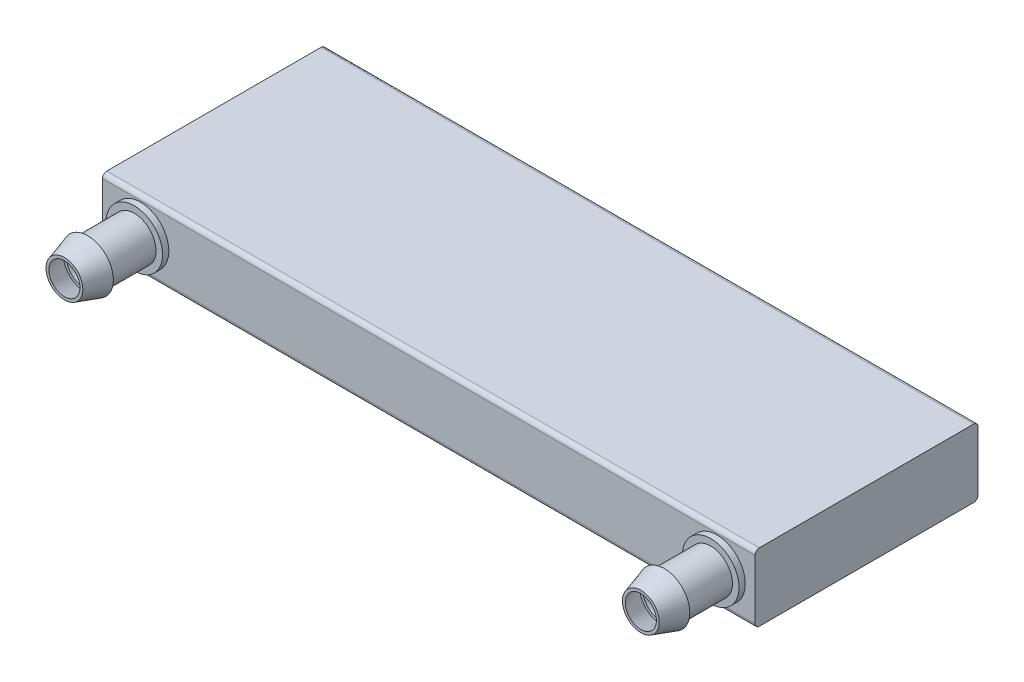
from build123d import *

# Parameters (mm, degrees)
SKETCH1_W           = 120
SKETCH1_H           = 41
BOSS_EXTRUDE1_DEPTH = 12.5
SKETCH2_R           = 5.2
BOSS_EXTRUDE2_DEPTH = 1.15
SKETCH3_R           = 4
BOSS_EXTRUDE3_DEPTH = 8.55
SKETCH4_R           = 4.7
BOSS_EXTRUDE4_DEPTH = 4.3
BOSS_EXTRUDE4_TAPER = 17
FILLET1_R           = 0.8
SHELL1_T            = -0.5


with BuildPart() as part:
    # Sketch1 → Boss-Extrude1 (new body)
    with BuildSketch(Plane(origin=(0, 0, 0), x_dir=(1, 0, 0), z_dir=(0, 1, 0))):
        Rectangle(SKETCH1_W, SKETCH1_H)
    extrude(amount=BOSS_EXTRUDE1_DEPTH)

    # Sketch2 → Boss-Extrude2 (add)
    with BuildSketch(Plane.XY.offset(20.5)):
        with Locations((53, 6.25)):
            Circle(SKETCH2_R)
    boss_extrude2 = extrude(amount=BOSS_EXTRUDE2_DEPTH)

    # Sketch3 → Boss-Extrude3 (add)
    with BuildSketch(Plane.XY.offset(21.65)):
        with Locations((53, 6.25)):
            Circle(SKETCH3_R)
    boss_extrude3 = extrude(amount=BOSS_EXTRUDE3_DEPTH)

    # Sketch4 → Boss-Extrude4 (add)
    with BuildSketch(Plane.XY.offset(30.2)):
        with Locations((53, 6.25)):
            Circle(SKETCH4_R)
    boss_extrude4 = extrude(amount=BOSS_EXTRUDE4_DEPTH, taper=BOSS_EXTRUDE4_TAPER)

    # Mirror1: Boss-Extrude2, Boss-Extrude3, Boss-Extrude4 across plane
    add(boss_extrude2.mirror(Plane(origin=(0, 0, 0), x_dir=(0, 0, 1), z_dir=(1, 0, 0))))
    add(boss_extrude3.mirror(Plane(origin=(0, 0, 0), x_dir=(0, 0, 1), z_dir=(1, 0, 0))))
    add(boss_extrude4.mirror(Plane(origin=(0, 0, 0), x_dir=(0, 0, 1), z_dir=(1, 0, 0))))

    # Fillet1
    fillet1_edges = [part.edges().sort_by_distance(p)[0] for p in [
        (0, 12.5, -20.5),
        (0, 12.5, 20.5),
        (0, 0, 20.5),
        (0, 0, -20.5),
    ]]
    fillet(fillet1_edges, radius=FILLET1_R)

    # Shell1
    shell1_openings = [part.faces().sort_by_distance(p)[0] for p in [
        (53, 6.25, 34.5),
        (-53, 6.25, 34.5),
    ]]
    offset(amount=SHELL1_T, openings=shell1_openings, kind=Kind.INTERSECTION)


solid = part.part
